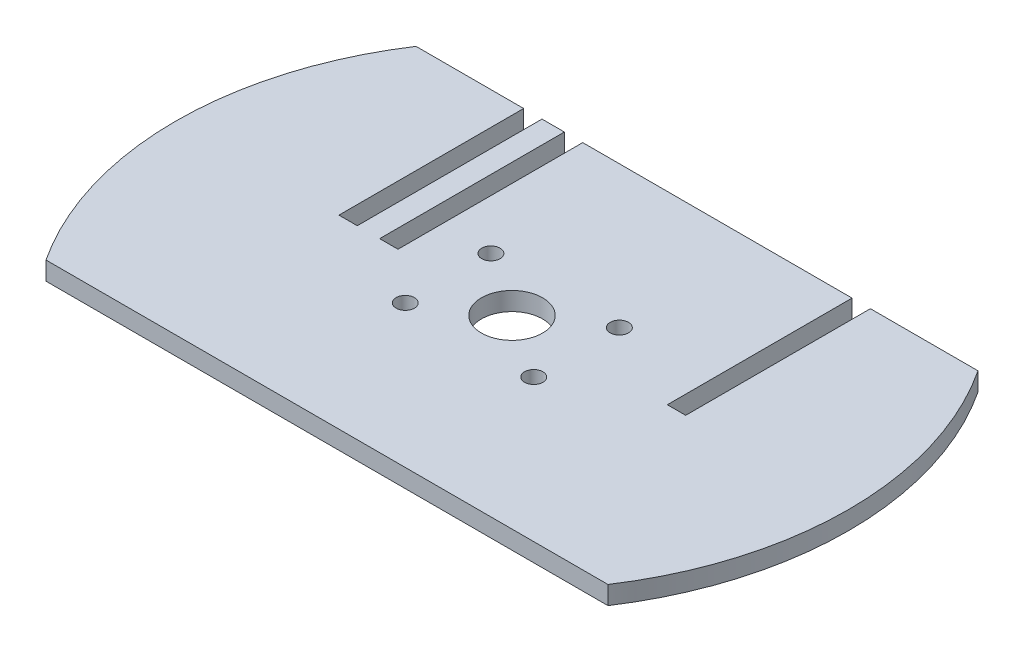
from build123d import *

# Parameters (mm, degrees)
BOSS_EXTRUDE1_DEPTH = 3
SKETCH4_R           = 5
CUT_EXTRUDE1_DEPTH  = 3
SKETCH6_R           = 1.5
CUT_EXTRUDE2_DEPTH  = 3
CUT_EXTRUDE3_DEPTH  = 3
SKETCH8_W           = 3
SKETCH8_H           = 30.2
CUT_EXTRUDE4_DEPTH  = 3


with BuildPart() as part:
    # Sketch3 → Boss-Extrude1 (new body)
    with BuildSketch(Plane(origin=(0, 0, 0), x_dir=(1, 0, 0), z_dir=(0, 1, 0))):
        with BuildLine():
            Line((-42.11236018, 3.702994226), (-22.11236018, 3.702994226))
            Line((-22.11236018, 3.702994226), (-22.11236018, -26.497005774))
            Line((-22.11236018, -26.497005774), (-19.11236018, -26.497005774))
            Line((-19.11236018, -26.497005774), (-19.11236018, 3.702994226))
            Line((-19.11236018, 3.702994226), (-15.45236018, 3.702994226))
            Line((-15.45236018, 3.702994226), (-12.45236018, 3.702994226))
            Line((-12.45236018, 3.702994226), (31.57763982, 3.702994226))
            Line((31.57763982, 3.702994226), (31.57763982, -26.497005774))
            Line((31.57763982, -26.497005774), (34.57763982, -26.497005774))
            Line((34.57763982, -26.497005774), (34.57763982, 3.702994226))
            Line((34.57763982, 3.702994226), (54.57763982, 3.702994226))
            ThreePointArc((54.57763982, 3.702994226), (61.648707631, 0.774062038), (64.57763982, -6.297005774))
            Line((64.57763982, -6.297005774), (64.57763982, -46.797005774))
            ThreePointArc((64.57763982, -46.797005774), (61.648707631, -53.868073586), (54.57763982, -56.797005774))
            Line((54.57763982, -56.797005774), (-42.11236018, -56.797005774))
            ThreePointArc((-42.11236018, -56.797005774), (-49.183427992, -53.868073586), (-52.11236018, -46.797005774))
            Line((-52.11236018, -46.797005774), (-52.11236018, -6.297005774))
            ThreePointArc((-52.11236018, -6.297005774), (-49.183427992, 0.774062038), (-42.11236018, 3.702994226))
        make_face()
    extrude(amount=BOSS_EXTRUDE1_DEPTH)

    # Sketch4 → Cut-Extrude1 (cut)
    with BuildSketch(Plane(origin=(0, 3, 0), x_dir=(1, 0, 0), z_dir=(0, 1, 0))):
        with Locations(Location((6.23263982, -26.547005774, 0), (0, 0, 270))):
            Circle(SKETCH4_R)
    extrude(amount=-CUT_EXTRUDE1_DEPTH, mode=Mode.SUBTRACT)

    # Sketch6 → Cut-Extrude2 (cut)
    with BuildSketch(Plane(origin=(0, 3, 0), x_dir=(1, 0, 0), z_dir=(0, 1, 0))):
        with Locations(Location((-4.26736018, -19.497005774, 0), (0, 0, 270))):
            Circle(SKETCH6_R)
        with Locations(Location((-4.26736018, -33.497005774, 0), (0, 0, 270))):
            Circle(SKETCH6_R)
        with Locations(Location((16.73263982, -19.497005774, 0), (0, 0, 270))):
            Circle(SKETCH6_R)
        with Locations(Location((16.73263982, -33.497005774, 0), (0, 0, 270))):
            Circle(SKETCH6_R)
    extrude(amount=-CUT_EXTRUDE2_DEPTH, mode=Mode.SUBTRACT)

    # Sketch7 → Cut-Extrude3 (cut)
    with BuildSketch(Plane(origin=(0, 3, 0), x_dir=(1, 0, 0), z_dir=(0, 1, 0))):
        with BuildLine():
            Line((52.166695813, 3.702994226), (73.459164028, 3.702994226))
            Line((73.459164028, 3.702994226), (73.459164028, -56.797005774))
            Line((73.459164028, -56.797005774), (52.166695813, -56.797005774))
            ThreePointArc((52.166695813, -56.797005774), (61.23263982, -26.547005774), (52.166695813, 3.702994226))
        make_face()
        with BuildLine():
            Line((-39.701416174, 3.702994226), (-60.819947715, 3.702994226))
            Line((-60.819947715, 3.702994226), (-60.819947715, -56.797005774))
            Line((-60.819947715, -56.797005774), (-39.701416174, -56.797005774))
            ThreePointArc((-39.701416174, -56.797005774), (-48.76736018, -26.547005774), (-39.701416174, 3.702994226))
        make_face()
    extrude(amount=-CUT_EXTRUDE3_DEPTH, mode=Mode.SUBTRACT)

    # Sketch8 → Cut-Extrude4 (cut)
    with BuildSketch(Plane(origin=(0, 3, 0), x_dir=(1, 0, 0), z_dir=(0, 1, 0))):
        with Locations((-13.95236018, -11.397005774)):
            Rectangle(SKETCH8_W, SKETCH8_H)
    extrude(amount=-CUT_EXTRUDE4_DEPTH, mode=Mode.SUBTRACT)


solid = part.part
